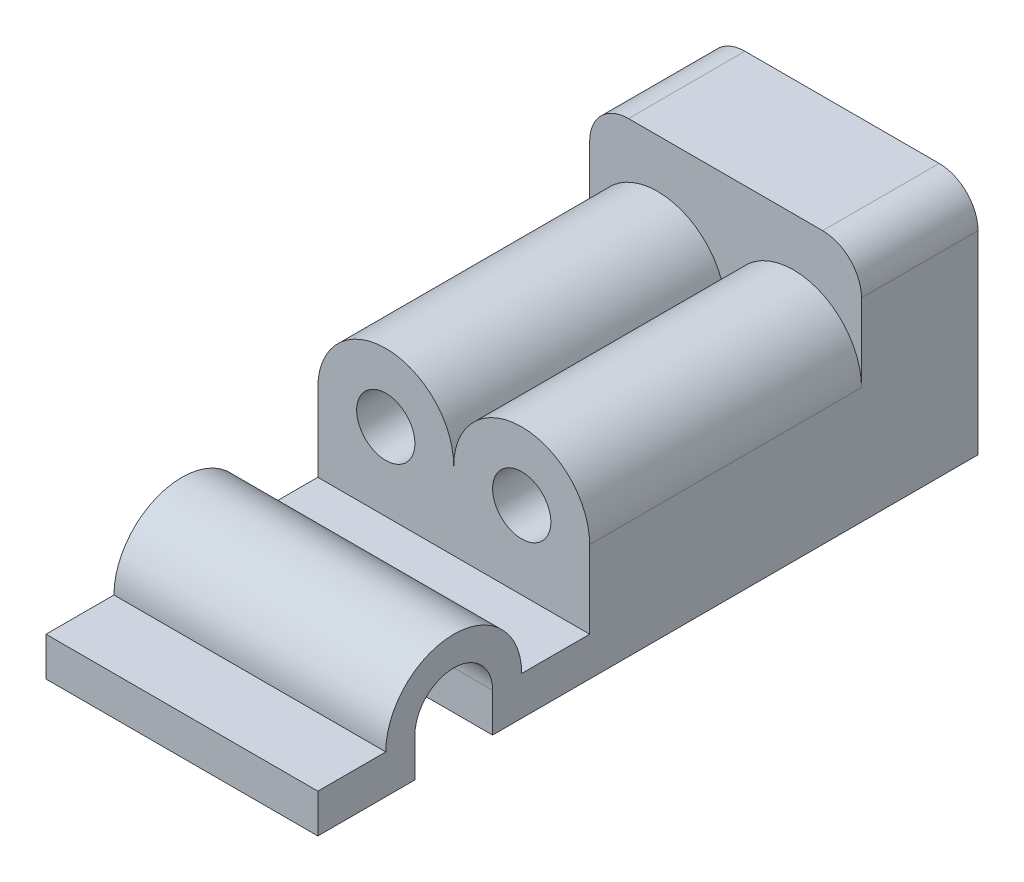
from build123d import *

# Parameters (mm, degrees)
SKETCH2_W           = 70
SKETCH2_H           = 60
BOSS_EXTRUDE1_DEPTH = 100
SKETCH3_R           = 7.5
CUT_EXTRUDE1_DEPTH  = 70
BOSS_EXTRUDE2_DEPTH = 70
FILLET1_R           = 10


with BuildPart() as part:
    # Sketch2 → Boss-Extrude1 (new body)
    with BuildSketch(Plane.XY):
        with Locations((0, 30)):
            Rectangle(SKETCH2_W, SKETCH2_H)
    extrude(amount=BOSS_EXTRUDE1_DEPTH)

    # Sketch3 → Cut-Extrude1 (cut)
    with BuildSketch(Plane.XY.offset(100)):
        with Locations((-17.5, 30)):
            Circle(SKETCH3_R)
        with Locations(Location((17.5, 30, 0), (0, 0, 180))):
            Circle(SKETCH3_R)
        with BuildLine():
            Line((35, 60), (-35, 60))
            Line((-35, 60), (-35, 30))
            ThreePointArc((-35, 30), (-17.5, 47.5), (0, 30))
            ThreePointArc((0, 30), (17.5, 47.5), (35, 30))
            Line((35, 30), (35, 60))
        make_face()
    extrude(amount=-CUT_EXTRUDE1_DEPTH, mode=Mode.SUBTRACT)

    # Sketch4 → Boss-Extrude2 (add)
    with BuildSketch(Plane.ZY.offset(35)):
        with BuildLine():
            Line((100, 0), (125, 0))
            Line((125, 0), (125, 10))
            ThreePointArc((125, 10), (135, 20), (145, 10))
            Line((145, 10), (145, 0))
            Line((145, 0), (170, 0))
            Line((170, 0), (170, 10))
            Line((170, 10), (152.5, 10))
            ThreePointArc((152.5, 10), (135, 27.5), (117.5, 10))
            Line((117.5, 10), (100, 10))
            Line((100, 10), (100, 0))
        make_face()
    extrude(amount=-BOSS_EXTRUDE2_DEPTH)

    # Fillet1
    fillet1_edges = [part.edges().sort_by_distance(p)[0] for p in [
        (-35, 60, 15),
        (35, 60, 15),
    ]]
    fillet(fillet1_edges, radius=FILLET1_R)


solid = part.part
